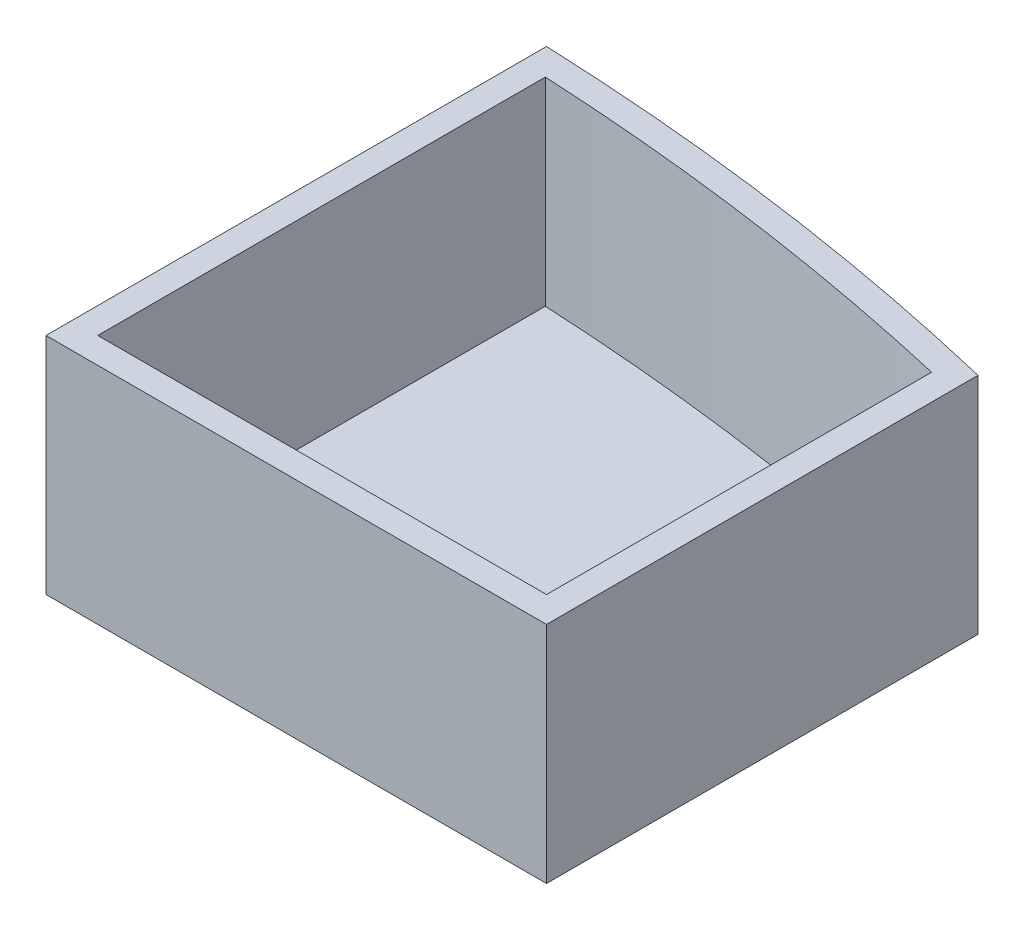
from build123d import *

# Parameters (mm, degrees)
BOSS_EXTRUDE2_DEPTH             = 3
BOSS_EXTRUDE3_DEPTH             = 23
SKETCH11_R                      = 3.5
BOSS_EXTRUDE5_DEPTH             = 7
BOSS_EXTRUDE5_DIRECTION_2_REACH = 74.228


with BuildPart() as part:
    # Sketch1 → Boss-Extrude2 (new body)
    with BuildSketch(Plane(origin=(0, 0, 0), x_dir=(1, 0, 0), z_dir=(0, 1, 0))):
        with BuildLine():
            Line((0, 0), (0, -58))
            Line((0, -58), (58, -58))
            Line((58, -58), (58, -8))
            ThreePointArc((58, -8), (29.195630572, -2.581678351), (0, 0))
        make_face()
    extrude(amount=BOSS_EXTRUDE2_DEPTH)

    # Sketch3 → Boss-Extrude3 (add)
    with BuildSketch(Plane(origin=(0, 3, 0), x_dir=(1, 0, 0), z_dir=(0, 1, 0))):
        with BuildLine():
            Line((58, -58), (58, -8))
            ThreePointArc((58, -8), (29.195630572, -2.581678351), (0, 0))
            Line((0, 0), (0, -58))
            Line((0, -58), (58, -58))
        make_face()
        with BuildLine():
            Line((3, -3.13678047), (3, -55))
            Line((3, -55), (55, -55))
            Line((55, -55), (55, -10.37667422))
            ThreePointArc((55, -10.37667422), (29.160290888, -5.60544993), (3, -3.13678047))
        make_face(mode=Mode.SUBTRACT)
    extrude(amount=BOSS_EXTRUDE3_DEPTH)

    # Sketch11 → Boss-Extrude5 (add)
    with BuildSketch(Plane(origin=(48.237428629, 13, 5.835989529), x_dir=(-0.9797734253164554, 0, -0.20011005732761197), z_dir=(0.20011005732761197, 0, -0.9797734253164554))):
        with Locations((19.215721312, 0)):
            Circle(SKETCH11_R)
    extrude(amount=BOSS_EXTRUDE5_DEPTH)

    # Sketch11 → Boss-Extrude5 direction 2 (add, up to next)
    with BuildSketch(Plane(origin=(48.237428629, 13, 5.835989529), x_dir=(-0.9797734253164554, 0, -0.20011005732761197), z_dir=(0.20011005732761197, 0, -0.9797734253164554)), mode=Mode.PRIVATE) as boss_extrude5_direction_2_sk1:
        with Locations((19.215721312, 0)):
            Circle(SKETCH11_R)
    boss_extrude5_direction_2_tool1 = extrude(boss_extrude5_direction_2_sk1.sketch, amount=-BOSS_EXTRUDE5_DIRECTION_2_REACH, mode=Mode.PRIVATE) - part.part
    add(boss_extrude5_direction_2_tool1.solids().sort_by_distance((29.410376, 13, 1.99073))[0])


solid = part.part
